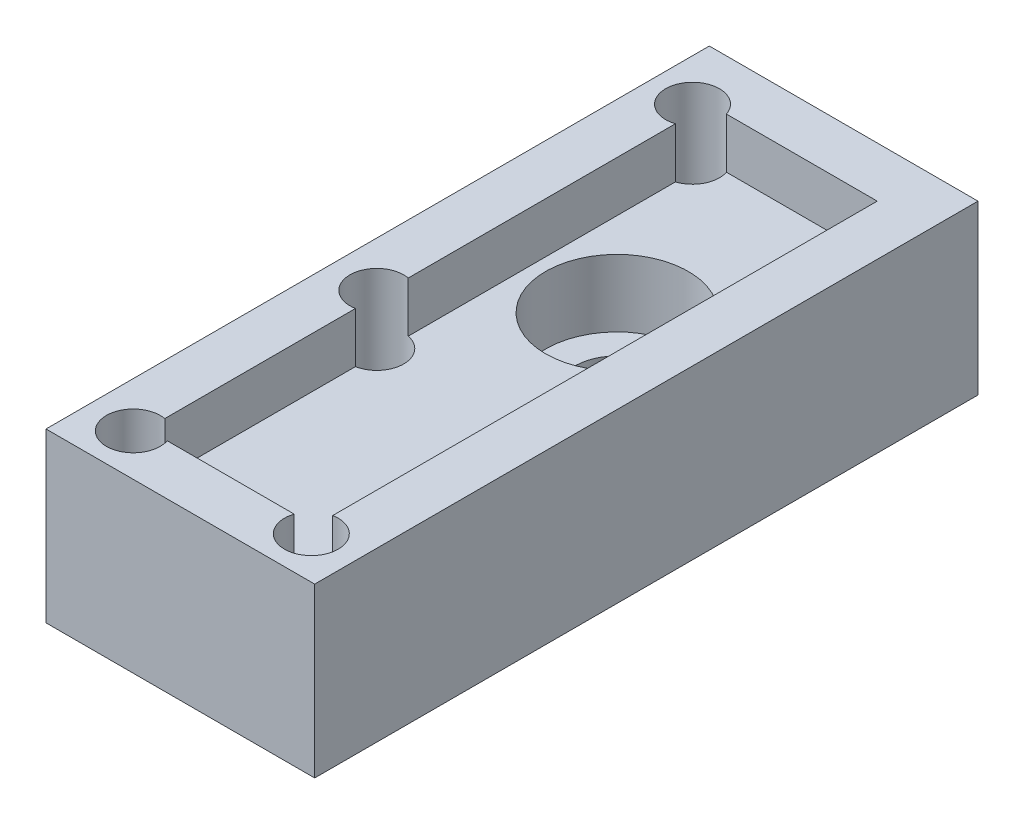
from build123d import *

# Parameters (mm, degrees)
SKETCH1_W               = 16
SKETCH1_H               = 39.5
BOSS_EXTRUDE1_DEPTH     = 15
SKETCH2_W               = 10
SKETCH2_H               = 33.5
CUT_EXTRUDE1_DEPTH      = 3
CUT_EXTRUDE2_DEPTH      = 45.274710615
CUT_EXTRUDE2_DEPTH_BACK = 45.274710615
SKETCH3_R               = 1.6
CUT_EXTRUDE3_DEPTH      = 3
CUT_EXTRUDE3_DEPTH_BACK = 46.180194776
SKETCH4_R               = 1.6
SKETCH5_R               = 2.5
CUT_EXTRUDE4_DEPTH      = 20
SKETCH8_R               = 4.25
CUT_EXTRUDE5_DEPTH      = 4
SKETCH9_W               = 23.074046619
SKETCH9_H               = 49.619494536
CUT_EXTRUDE6_DEPTH      = 5


with BuildPart() as part:
    # Sketch1 → Boss-Extrude1 (new body)
    with BuildSketch(Plane(origin=(0, 0, 0), x_dir=(1, 0, 0), z_dir=(0, 1, 0))):
        with Locations((8, 19.75)):
            Rectangle(SKETCH1_W, SKETCH1_H)
    extrude(amount=BOSS_EXTRUDE1_DEPTH)

    # Sketch2 → Cut-Extrude1 (cut)
    with BuildSketch(Plane(origin=(0, 15, 0), x_dir=(1, 0, 0), z_dir=(0, 1, 0))):
        with Locations((8, 19.75)):
            Rectangle(SKETCH2_W, SKETCH2_H)
    extrude(amount=-CUT_EXTRUDE1_DEPTH, mode=Mode.SUBTRACT)

    # Sketch3 → Cut-Extrude2 (cut, two sides: drawn at the far end of the back side and taken through both)
    with BuildSketch(Plane(origin=(0, 12, 0), x_dir=(1, 0, 0), z_dir=(0, 1, 0)).offset(-CUT_EXTRUDE2_DEPTH_BACK)):
        with Locations((2.7, 2.5)):
            Circle(SKETCH3_R)
    extrude(amount=CUT_EXTRUDE2_DEPTH + CUT_EXTRUDE2_DEPTH_BACK, mode=Mode.SUBTRACT)

    # Sketch4 → Cut-Extrude3 (cut, two sides: drawn at the far end of the back side and taken through both)
    with BuildSketch(Plane(origin=(0, 15, 0), x_dir=(1, 0, 0), z_dir=(0, 1, 0)).offset(-CUT_EXTRUDE3_DEPTH_BACK)):
        with Locations((13.3, 2.5)):
            Circle(SKETCH4_R)
        with Locations((2.7, 17)):
            Circle(SKETCH4_R)
        with Locations((2.5, 36)):
            Circle(SKETCH4_R)
    extrude(amount=CUT_EXTRUDE3_DEPTH + CUT_EXTRUDE3_DEPTH_BACK, mode=Mode.SUBTRACT)

    # Sketch5 → Cut-Extrude4 (cut)
    with BuildSketch(Plane(origin=(0, 12, 0), x_dir=(1, 0, 0), z_dir=(0, 1, 0))):
        with Locations((8, 26)):
            Circle(SKETCH5_R)
    extrude(amount=-CUT_EXTRUDE4_DEPTH, mode=Mode.SUBTRACT)

    # Sketch8 → Cut-Extrude5 (cut)
    with BuildSketch(Plane(origin=(0, 12, 0), x_dir=(1, 0, 0), z_dir=(0, 1, 0))):
        with Locations((8, 26)):
            Circle(SKETCH8_R)
    extrude(amount=-CUT_EXTRUDE5_DEPTH, mode=Mode.SUBTRACT)

    # Sketch9 → Cut-Extrude6 (cut)
    with BuildSketch(Plane.XZ):
        with Locations((7.55036405, -17.360616358)):
            Rectangle(SKETCH9_W, SKETCH9_H)
    extrude(amount=-CUT_EXTRUDE6_DEPTH, mode=Mode.SUBTRACT)


solid = part.part
